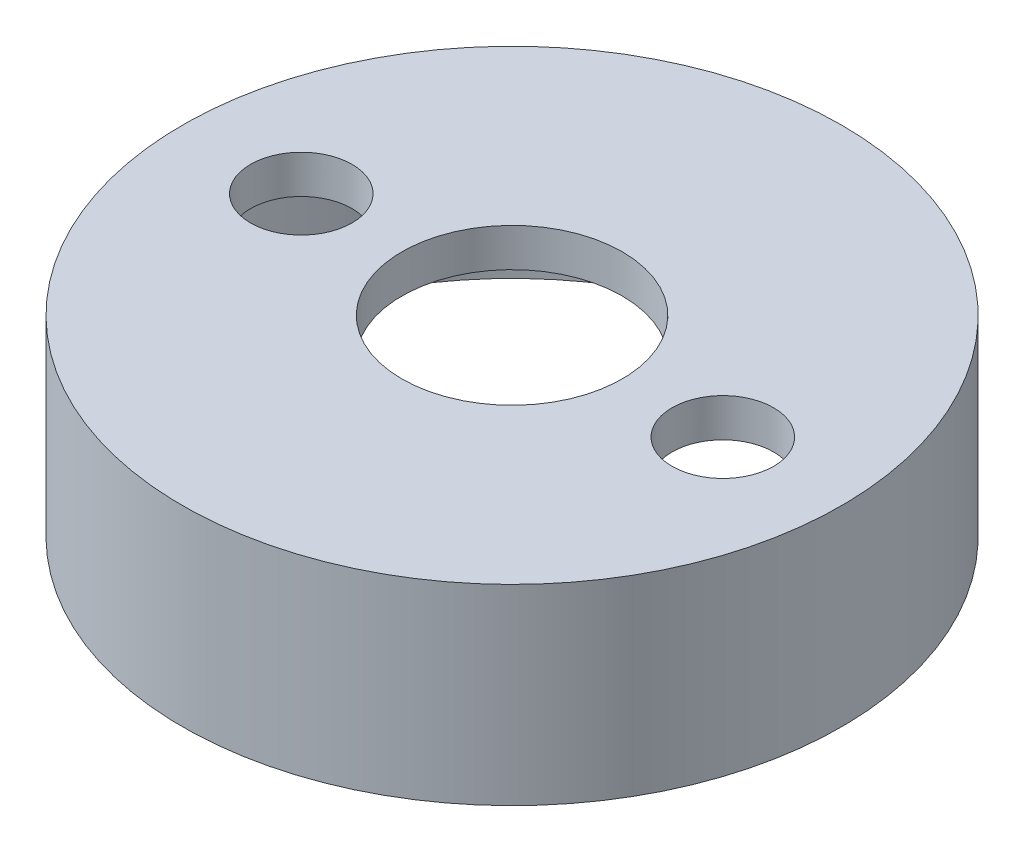
from build123d import *

# Parameters (mm, degrees)
SKETCH2_R          = 2.65
CUT_EXTRUDE1_DEPTH = 10


with BuildPart() as part:
    # Sketch1 → Revolve1 (revolve)
    with BuildSketch(Plane.XY, mode=Mode.PRIVATE) as revolve1_sk:
        Polygon((5.75, 10), (17.2, 10), (17.2, 0), (16.5, 0), (16.5, 8), (5.75, 8), align=None)
    revolve(revolve1_sk.sketch.rotate(Axis((0, -9.26010101, 0), (0, 1, 0)), 90), axis=Axis((0, -9.26010101, 0), (0, 1, 0)))

    # Sketch2 → Cut-Extrude1 (cut)
    with BuildSketch(Plane.XZ.offset(-8)):
        with Locations(Location((-11, 0, 0), (0, 0, 270))):
            Circle(SKETCH2_R)
        with Locations(Location((11, 0, 0), (0, 0, 270))):
            Circle(SKETCH2_R)
    extrude(amount=-CUT_EXTRUDE1_DEPTH, mode=Mode.SUBTRACT)


solid = part.part
